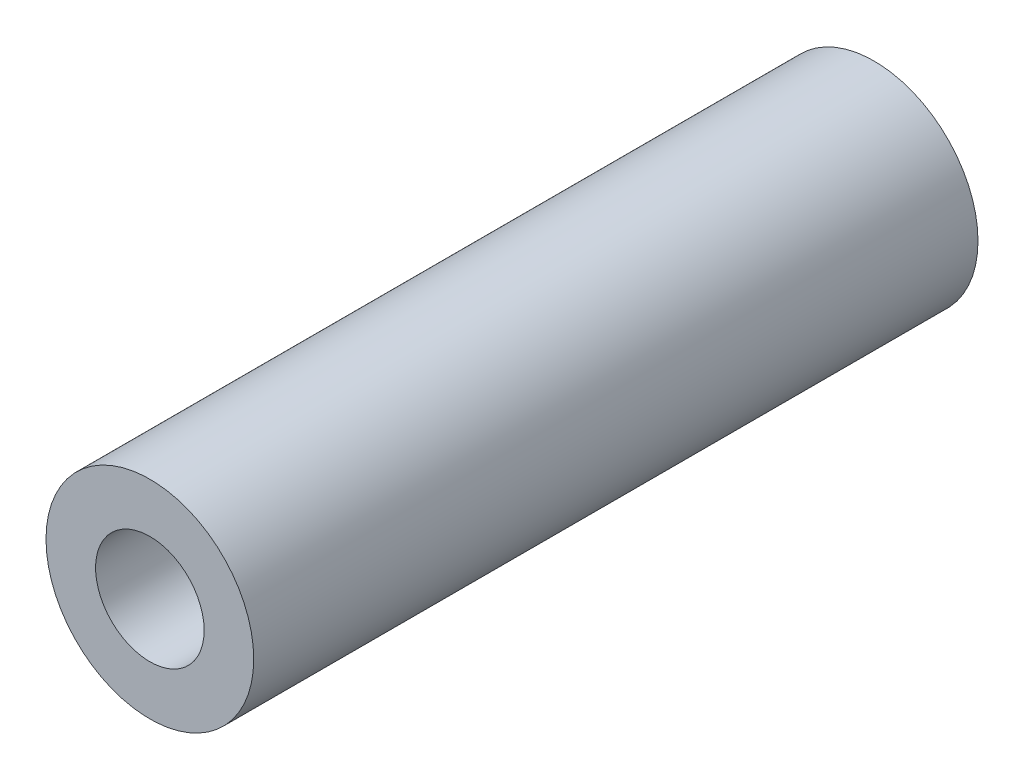
from build123d import *

# Parameters (mm, degrees)
SKETCH1_R           = 4.7625
BOSS_EXTRUDE1_DEPTH = 16.60525
SKETCH2_R           = 2.4892
CUT_EXTRUDE1_DEPTH  = 34.886577324


with BuildPart() as part:
    # Sketch1 → Boss-Extrude1 (new, symmetric)
    with BuildSketch(Plane.XY):
        Circle(SKETCH1_R)
    extrude(amount=BOSS_EXTRUDE1_DEPTH, both=True)

    # Sketch2 → Cut-Extrude1 (cut, through all)
    with BuildSketch(Plane.XY.offset(16.60525)):
        Circle(SKETCH2_R)
    extrude(amount=-CUT_EXTRUDE1_DEPTH, mode=Mode.SUBTRACT)


solid = part.part
